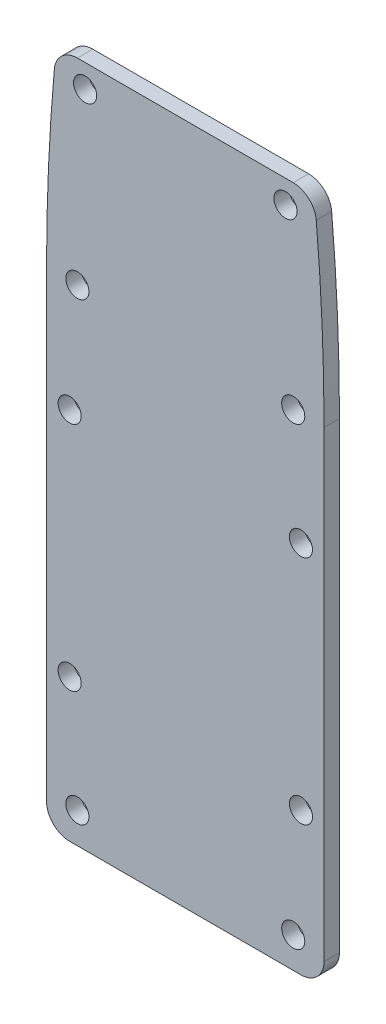
from build123d import *

# Parameters (mm, degrees)
SKETCH1_R           = 1.5
BOSS_EXTRUDE1_DEPTH = 2
FILLET1_R           = 3


with BuildPart() as part:
    # Sketch1 → Boss-Extrude1 (new body)
    with BuildSketch(Plane.XY):
        with BuildLine():
            Line((-18, 29.5), (-18, -33.5))
            Line((-18, -33.5), (18, -33.5))
            Line((18, -33.5), (18, 29.5))
            ThreePointArc((18, 29.5), (17.746918084, 40.89430747), (16.988171513, 52.266140956))
            ThreePointArc((16.988171513, 52.266140956), (16.025040386, 54.213416236), (14, 55))
            Line((14, 55), (-14, 55))
            ThreePointArc((-14, 55), (-16.025040386, 54.213416236), (-16.988171513, 52.266140956))
            ThreePointArc((-16.988171513, 52.266140956), (-17.746918084, 40.89430747), (-18, 29.5))
        make_face()
        with Locations((-14, 29.5)):
            Circle(SKETCH1_R, mode=Mode.SUBTRACT)
        with Locations((14, 29.5)):
            Circle(SKETCH1_R, mode=Mode.SUBTRACT)
        with Locations((-14, -29.5)):
            Circle(SKETCH1_R, mode=Mode.SUBTRACT)
        with Locations((14, -29.5)):
            Circle(SKETCH1_R, mode=Mode.SUBTRACT)
        with Locations((15, 15)):
            Circle(SKETCH1_R, mode=Mode.SUBTRACT)
        with Locations((15, -15)):
            Circle(SKETCH1_R, mode=Mode.SUBTRACT)
        with Locations((-15, -15)):
            Circle(SKETCH1_R, mode=Mode.SUBTRACT)
        with Locations((-15, 15)):
            Circle(SKETCH1_R, mode=Mode.SUBTRACT)
        with Locations((-13, 52)):
            Circle(SKETCH1_R, mode=Mode.SUBTRACT)
        with Locations((13, 52)):
            Circle(SKETCH1_R, mode=Mode.SUBTRACT)
    extrude(amount=BOSS_EXTRUDE1_DEPTH)

    # Fillet1
    fillet1_edges = [part.edges().sort_by_distance(p)[0] for p in [
        (18, -33.5, 1),
        (-18, -33.5, 1),
    ]]
    fillet(fillet1_edges, radius=FILLET1_R)


solid = part.part
